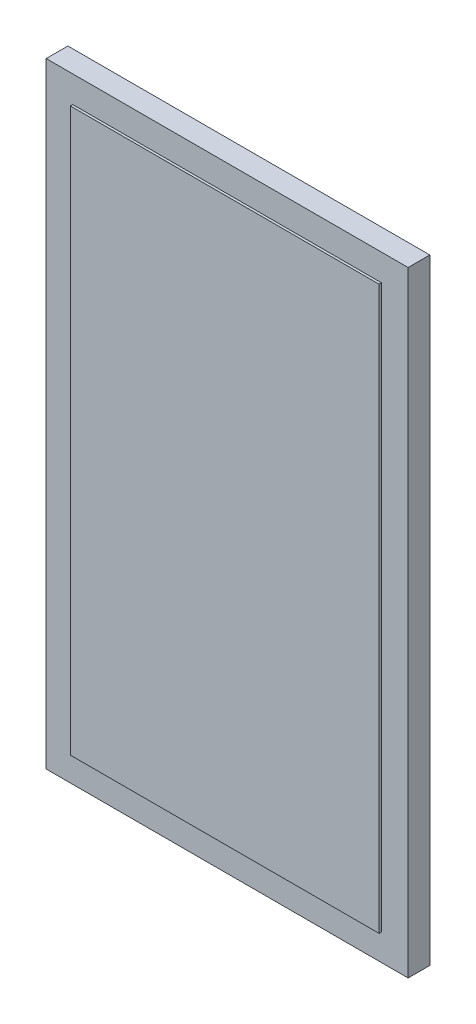
from build123d import *

# Parameters (mm, degrees)
ESQUISSE1_W             = 150
ESQUISSE1_H             = 255
BOSS_EXTRU_1_DEPTH      = 10
ESQUISSE2_W             = 150
ESQUISSE2_H             = 255
ESQUISSE2_W_2           = 128
ESQUISSE2_H_2           = 233
ENL_V_MAT_EXTRU_1_DEPTH = 1


with BuildPart() as part:
    # Esquisse1 → Boss.-Extru.1 (new body)
    with BuildSketch(Plane.XY):
        Rectangle(ESQUISSE1_W, ESQUISSE1_H)
    extrude(amount=BOSS_EXTRU_1_DEPTH)

    # Esquisse2 → Enlèv. mat.-Extru.1 (cut)
    with BuildSketch(Plane.XY.offset(10)):
        Rectangle(ESQUISSE2_W, ESQUISSE2_H)
        Rectangle(ESQUISSE2_W_2, ESQUISSE2_H_2, mode=Mode.SUBTRACT)
    extrude(amount=-ENL_V_MAT_EXTRU_1_DEPTH, mode=Mode.SUBTRACT)


solid = part.part
